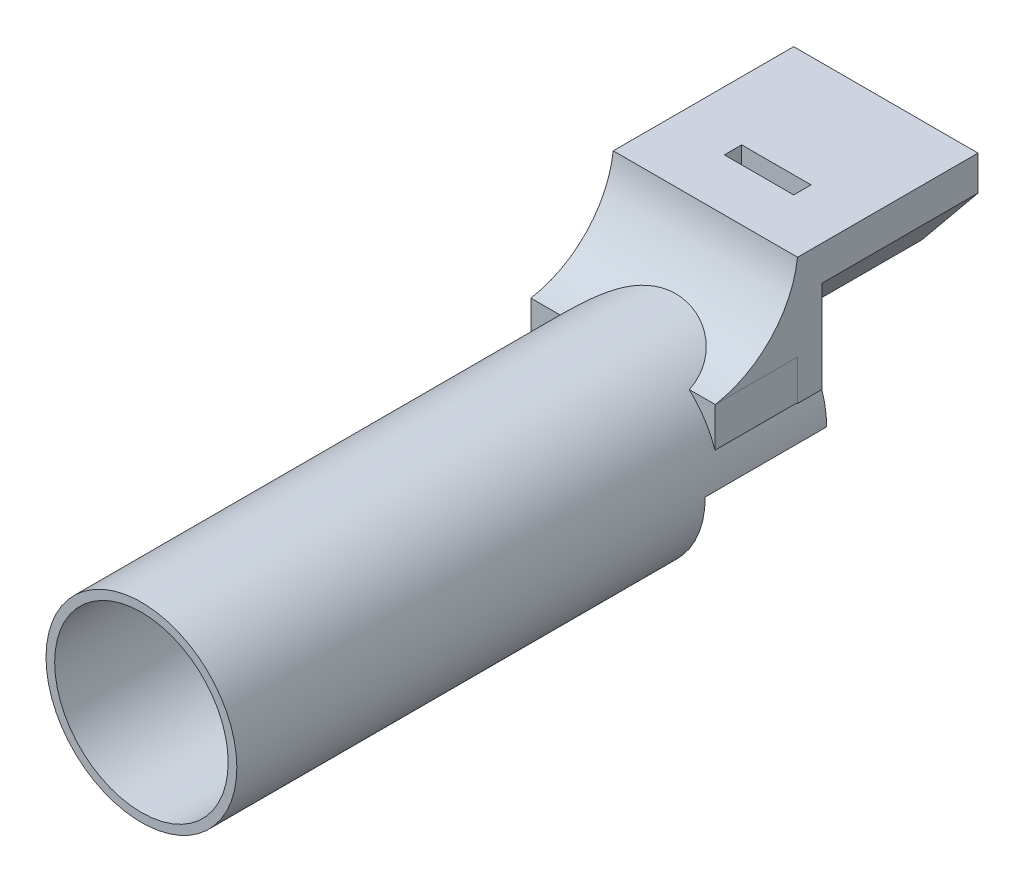
from build123d import *

# Parameters (mm, degrees)
SKETCH1_R               = 27.5
SKETCH1_R_2             = 25
BOSS_EXTRUDE1_DEPTH     = 170
SKETCH5_R               = 25
SKETCH5_R_2             = 15.5
BOSS_EXTRUDE5_DEPTH     = 80
CUT_EXTRUDE3_REACH      = 176.392
CUT_EXTRUDE3_END_RADIUS = 27.5
SKETCH7_W               = 30
SKETCH7_H               = 10
SKETCH9_W               = 2
SKETCH9_H               = 10
BOSS_EXTRUDE6_DEPTH     = 5
SKETCH10_W              = 30
SKETCH10_H              = 10
BOSS_EXTRUDE7_DEPTH     = 3
CUT_EXTRUDE4_REACH      = 182.932
SKETCH11_R              = 1.5
EXTRUDE_2_DEPTH         = 7
SKETCH_9_W              = 161.763477791
SKETCH_9_H              = 49.991844809
CUT_EXTRUDE_2_DEPTH     = 35
SKETCH_10_W             = 53.121044409
SKETCH_10_H             = 10
EXTRUDE_3_DEPTH         = 45
CUT_EXTRUDE_3_REACH     = 185.252
SKETCH_12_W             = 20
SKETCH_12_H             = 5
EXTRUDE_START           = 50
EXTRUDE_4_DEPTH         = 50
EXTRUDE_START_2         = -53.121045
EXTRUDE_5_DEPTH         = 53.121045
EXTRUDE_7_DEPTH         = 23.733
EXTRUDE_8_DEPTH         = 23.733
EXTRUDE_11_DEPTH        = 45


with BuildPart() as part:
    # Sketch1 → Boss-Extrude1 (new body)
    with BuildSketch(Plane.XY):
        Circle(SKETCH1_R)
        Circle(SKETCH1_R_2, mode=Mode.SUBTRACT)
    extrude(amount=BOSS_EXTRUDE1_DEPTH)

    # Sketch5 → Boss-Extrude5 (add)
    with BuildSketch(Plane(origin=(0, 0, 50), x_dir=(-1, 0, 0), z_dir=(0, 0, -1))):
        Circle(SKETCH5_R)
        Circle(SKETCH5_R_2, mode=Mode.SUBTRACT)
    extrude(amount=-BOSS_EXTRUDE5_DEPTH)

    # Cut-Extrude3: up to this cylinder (the profile starts inside it)
    cut_extrude3_end = Plane(origin=(0, 0, 5), z_dir=(0, 0, -1)) * Cylinder(CUT_EXTRUDE3_END_RADIUS, 408.784, mode=Mode.PRIVATE)
    # Sketch7 → Cut-Extrude3 (cut, up to the surface)
    with BuildSketch(Plane(origin=(0, 0, 0), x_dir=(1, 0, 0), z_dir=(0, 1, 0)), mode=Mode.PRIVATE) as cut_extrude3_sk1:
        with Locations((0, -5)):
            Rectangle(SKETCH7_W, SKETCH7_H)
    cut_extrude3_tool1 = extrude(cut_extrude3_sk1.sketch, amount=-CUT_EXTRUDE3_REACH, mode=Mode.PRIVATE) & cut_extrude3_end
    add(cut_extrude3_tool1.solids().sort_by_distance((0, 0, 5))[0], mode=Mode.SUBTRACT)

    # Sketch9 → Boss-Extrude6 (add)
    with BuildSketch(Plane(origin=(0, -20, 0), x_dir=(-1, 0, 0), z_dir=(0, -1, 0))):
        with Locations((-14, -5)):
            Rectangle(SKETCH9_W, SKETCH9_H)
        with Locations((14, -5)):
            Rectangle(SKETCH9_W, SKETCH9_H)
    extrude(amount=BOSS_EXTRUDE6_DEPTH)

    # Sketch10 → Boss-Extrude7 (add)
    with BuildSketch(Plane(origin=(0, -25, 0), x_dir=(-1, 0, 0), z_dir=(0, -1, 0))):
        with Locations((0, -5)):
            Rectangle(SKETCH10_W, SKETCH10_H)
    extrude(amount=BOSS_EXTRUDE7_DEPTH)

    # Sketch11 → Cut-Extrude4 (cut, up to next)
    with BuildSketch(Plane(origin=(0, -28, 0), x_dir=(-1, 0, 0), z_dir=(0, -1, 0)), mode=Mode.PRIVATE) as cut_extrude4_sk1:
        with Locations(Location((-10, -2, 0), (0, 0, 90))):
            Circle(SKETCH11_R)
    cut_extrude4_tool1 = extrude(cut_extrude4_sk1.sketch, amount=-CUT_EXTRUDE4_REACH, mode=Mode.PRIVATE) & part.part
    # Sketch11 → Cut-Extrude4 (cut, up to next)
    with BuildSketch(Plane(origin=(0, -28, 0), x_dir=(-1, 0, 0), z_dir=(0, -1, 0)), mode=Mode.PRIVATE) as cut_extrude4_sk2:
        with Locations(Location((10, -2, 0), (0, 0, 90))):
            Circle(SKETCH11_R)
    cut_extrude4_tool2 = extrude(cut_extrude4_sk2.sketch, amount=-CUT_EXTRUDE4_REACH, mode=Mode.PRIVATE) & part.part
    add(cut_extrude4_tool1.solids().sort_by_distance((10, -28, 2))[0], mode=Mode.SUBTRACT)
    add(cut_extrude4_tool2.solids().sort_by_distance((-10, -28, 2))[0], mode=Mode.SUBTRACT)

    # 草图2 → 凸台-拉伸2 (add)
    with BuildSketch(Plane(origin=(0, 0, 0), x_dir=(-1, 0, 0), z_dir=(0, 0, -1))):
        with BuildLine():
            Line((27.013626396, 45.149173619), (-26.107418013, 45.149173619))
            Line((-26.107418013, 45.149173619), (-26.107418013, 8.640180826))
            ThreePointArc((-26.107418013, 8.640180826), (1.803354164, 27.440807455), (27.013626396, 5.149173619))
            Line((27.013626396, 5.149173619), (27.013626396, 45.149173619))
        make_face()
    extrude(amount=-EXTRUDE_2_DEPTH)

    # 草图9 → 切除-拉伸2 (cut)
    with BuildSketch(Plane.XY.offset(35)):
        with Locations((0.03623335, -24.995922404)):
            Rectangle(SKETCH_9_W, SKETCH_9_H)
    extrude(amount=-CUT_EXTRUDE_2_DEPTH, mode=Mode.SUBTRACT)

    # 草图10 → 凸台-拉伸3 (add)
    with BuildSketch(Plane(origin=(0, 0, 0), x_dir=(-1, 0, 0), z_dir=(0, 0, -1))):
        with Locations((0.453104192, 40.149173619)):
            Rectangle(SKETCH_10_W, SKETCH_10_H)
    extrude(amount=EXTRUDE_3_DEPTH)

    # 草图12 → 切除-拉伸3 (cut, up to next)
    with BuildSketch(Plane.XZ.offset(-35.149173619), mode=Mode.PRIVATE) as cut_extrude_3_sk1:
        with Locations((0, -10.5)):
            Rectangle(SKETCH_12_W, SKETCH_12_H)
    cut_extrude_3_tool1 = extrude(cut_extrude_3_sk1.sketch, amount=-CUT_EXTRUDE_3_REACH, mode=Mode.PRIVATE) & part.part
    add(cut_extrude_3_tool1.solids().sort_by_distance((0, 35.149174, -10.5))[0], mode=Mode.SUBTRACT)

    # 草图16 → 凸台-拉伸4 (add)
    with BuildSketch(Plane(origin=(0, 0, 50), x_dir=(-1, 0, 0), z_dir=(0, 0, -1)).offset(EXTRUDE_START)):
        with BuildLine():
            Line((19.338407085, 15.843800409), (-19.742236665, 15.337669036))
            ThreePointArc((-19.742236665, 15.337669036), (-0.323746543, 24.997903676), (19.338407085, 15.843800409))
        make_face()
    extrude(amount=-EXTRUDE_4_DEPTH)

    # 草图18 → 凸台-拉伸5 (add)
    with BuildSketch(Plane.ZY.offset(27.013626396).offset(EXTRUDE_START_2)):
        with BuildLine():
            Line((7, 45.149173619), (7, 20.249107981))
            Line((7, 20.249107981), (30.733278624, 20.249107981))
            ThreePointArc((30.733278624, 20.249107981), (14.73577697, 28.761845679), (7, 45.149173619))
        make_face()
    extrude(amount=EXTRUDE_5_DEPTH)

    # 草图21 → 凸台-拉伸7 (add)
    with BuildSketch(Plane.XY.offset(7)):
        Polygon((26.107418013, 20.249107981), (26.045212955, 8.825921037), (18.607085371, 20.249107981), align=None)
    extrude(amount=EXTRUDE_7_DEPTH)

    # 草图23 → 凸台-拉伸8 (add)
    with BuildSketch(Plane.XY.offset(7)):
        Polygon((-18.607085371, 20.249107981), (-27.013626396, 5.149173619), (-27.013626396, 20.249107981), align=None)
    extrude(amount=EXTRUDE_8_DEPTH)

    # 草图24 → 凸台-拉伸11 (add)
    with BuildSketch(Plane(origin=(0, 0, 0), x_dir=(-1, 0, 0), z_dir=(0, 0, -1))):
        Polygon((-26.107418013, 35.149173619), (-10, 35.149173619), (-10, 15.463840233), align=None)
        Polygon((27.013626396, 35.149173619), (10, 35.149173619), (10, 15.722859188), align=None)
    extrude(amount=EXTRUDE_11_DEPTH)


solid = part.part
